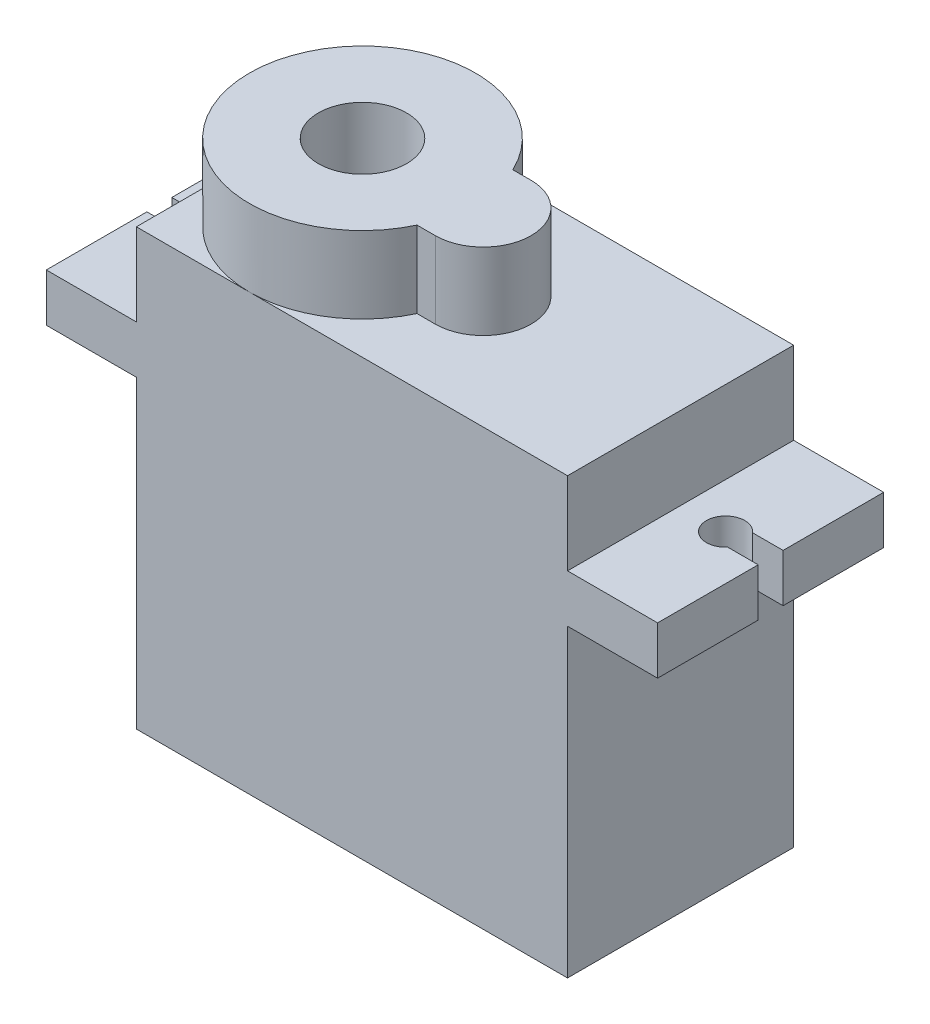
from build123d import *

# Parameters (mm, degrees)
BOSS_EXTRUDE1_DEPTH = 11.8
BOSS_EXTRUDE2_DEPTH = 4
SKETCH3_R           = 2.3
CUT_EXTRUDE1_DEPTH  = 4
CUT_EXTRUDE2_DEPTH  = 4


with BuildPart() as part:
    # Sketch1 → Boss-Extrude1 (new body)
    with BuildSketch(Plane.XY):
        Polygon((0, 0), (22.5, 0), (22.5, 15.9), (27.2, 15.9), (27.2, 18.4), (22.5, 18.4), (22.5, 22.7), (0, 22.7), (0, 18.4), (-4.7, 18.4), (-4.7, 15.9), (0, 15.9), align=None)
    extrude(amount=BOSS_EXTRUDE1_DEPTH)

    # Sketch2 → Boss-Extrude2 (add)
    with BuildSketch(Plane(origin=(0, 22.7, 0), x_dir=(1, 0, 0), z_dir=(0, 1, 0))):
        with BuildLine():
            Line((12.2, -3.4), (11.244155686, -3.4))
            ThreePointArc((11.244155686, -3.4), (0, -5.9), (11.244155686, -8.4))
            Line((11.244155686, -8.4), (12.2, -8.4))
            ThreePointArc((12.2, -8.4), (14.7, -5.9), (12.2, -3.4))
        make_face()
    extrude(amount=BOSS_EXTRUDE2_DEPTH)

    # Sketch3 → Cut-Extrude1 (cut)
    with BuildSketch(Plane(origin=(0, 26.7, 0), x_dir=(1, 0, 0), z_dir=(0, 1, 0))):
        with Locations(Location((5.9, -5.9, 0), (0, 0, 270))):
            Circle(SKETCH3_R)
    extrude(amount=-CUT_EXTRUDE1_DEPTH, mode=Mode.SUBTRACT)

    # Sketch4 → Cut-Extrude2 (cut)
    with BuildSketch(Plane(origin=(0, 18.4, 0), x_dir=(1, 0, 0), z_dir=(0, 1, 0))):
        with BuildLine():
            Line((-4.7, -5.25), (-4.7, -6.55))
            Line((-4.7, -6.55), (-3.109934208, -6.55))
            ThreePointArc((-3.109934208, -6.55), (-1.35, -5.9), (-3.109934208, -5.25))
            Line((-3.109934208, -5.25), (-4.7, -5.25))
        make_face()
    cut_extrude2 = extrude(amount=-CUT_EXTRUDE2_DEPTH, mode=Mode.SUBTRACT)

    # Mirror1: Cut-Extrude2 across plane
    add(cut_extrude2.mirror(Plane(origin=(11.25, 0, 0), x_dir=(0, 0, 1), z_dir=(1, 0, 0))), mode=Mode.SUBTRACT)


solid = part.part
